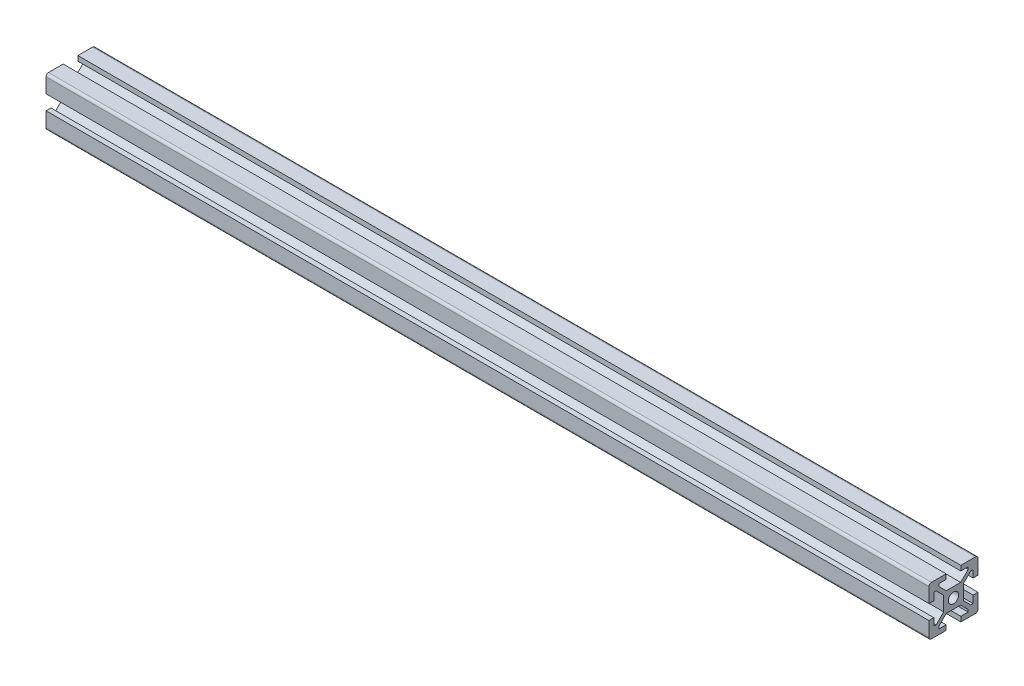
from build123d import *

# Parameters (mm, degrees)
SKETCH1_R           = 2.1
BOSS_EXTRUDE1_DEPTH = 360


with BuildPart() as part:
    # Sketch1 → Boss-Extrude1 (new body)
    with BuildSketch(Plane(origin=(0, 0, 0), x_dir=(0, 0, -1), z_dir=(1, 0, 0))):
        with BuildLine():
            Line((-10, 9), (-10, 3))
            Line((-10, 3), (-8, 3))
            Line((-8, 3), (-8, 6))
            Line((-8, 6), (-7.060660172, 6))
            Line((-7.060660172, 6), (-4, 2.939339828))
            Line((-4, 2.939339828), (-4, -2.939339828))
            Line((-4, -2.939339828), (-7.060660172, -6))
            Line((-7.060660172, -6), (-8, -6))
            Line((-8, -6), (-8, -3))
            Line((-8, -3), (-10, -3))
            Line((-10, -3), (-10, -9))
            ThreePointArc((-10, -9), (-9.707106781, -9.707106781), (-9, -10))
            Line((-9, -10), (-3, -10))
            Line((-3, -10), (-3, -8))
            Line((-3, -8), (-6, -8))
            Line((-6, -8), (-6, -7.060660172))
            Line((-6, -7.060660172), (-2.939339828, -4))
            Line((-2.939339828, -4), (2.939339828, -4))
            Line((2.939339828, -4), (6, -7.060660172))
            Line((6, -7.060660172), (6, -8))
            Line((6, -8), (3, -8))
            Line((3, -8), (3, -10))
            Line((3, -10), (9, -10))
            ThreePointArc((9, -10), (9.707106781, -9.707106781), (10, -9))
            Line((10, -9), (10, -3))
            Line((10, -3), (8, -3))
            Line((8, -3), (8, -6))
            Line((8, -6), (7.060660172, -6))
            Line((7.060660172, -6), (4, -2.939339828))
            Line((4, -2.939339828), (4, 2.939339828))
            Line((4, 2.939339828), (7.060660172, 6))
            Line((7.060660172, 6), (8, 6))
            Line((8, 6), (8, 3))
            Line((8, 3), (10, 3))
            Line((10, 3), (10, 9))
            ThreePointArc((10, 9), (9.707106781, 9.707106781), (9, 10))
            Line((9, 10), (3, 10))
            Line((3, 10), (3, 8))
            Line((3, 8), (6, 8))
            Line((6, 8), (6, 7.060660172))
            Line((6, 7.060660172), (2.939339828, 4))
            Line((2.939339828, 4), (-2.939339828, 4))
            Line((-2.939339828, 4), (-6, 7.060660172))
            Line((-6, 7.060660172), (-6, 8))
            Line((-6, 8), (-3, 8))
            Line((-3, 8), (-3, 10))
            Line((-3, 10), (-9, 10))
            ThreePointArc((-9, 10), (-9.707106781, 9.707106781), (-10, 9))
        make_face()
        Circle(SKETCH1_R, mode=Mode.SUBTRACT)
    extrude(amount=BOSS_EXTRUDE1_DEPTH)


solid = part.part
